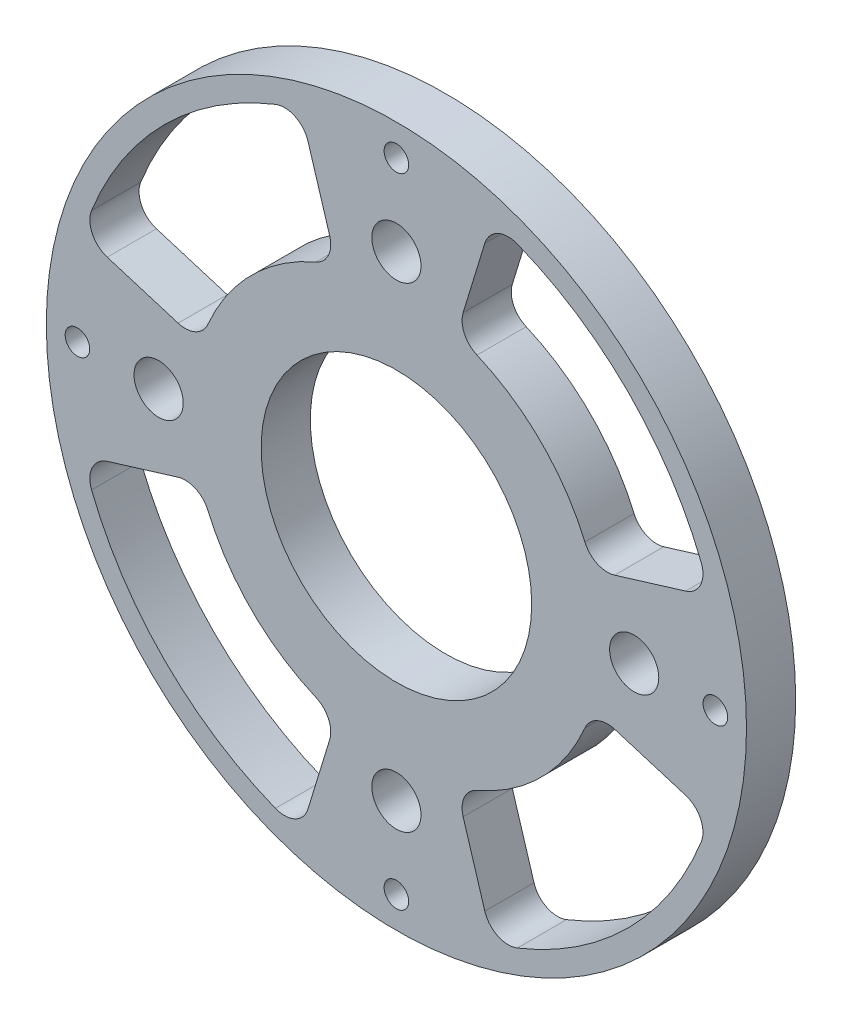
from build123d import *

# Parameters (mm, degrees)
SKETCH_2_R          = 43
SKETCH_2_R_2        = 16.5
EXTRUDE_1_DEPTH     = 6
SKETCH_3_R          = 3
SKETCH_3_R_2        = 1.5
CUT_EXTRUDE_1_DEPTH = 6
CUT_EXTRUDE_5_DEPTH = 6
FILLET_2_R          = 3
SKETCH_6_R          = 43
SKETCH_6_R_2        = 42.9
CUT_EXTRUDE_6_DEPTH = 6
CUT_EXTRUDE_START   = -6
SKETCH_7_R          = 42.9
SKETCH_7_R_2        = 42.7
CUT_EXTRUDE_7_DEPTH = 6


with BuildPart() as part:
    # 草图2 → 凸台-拉伸1 (new body)
    with BuildSketch(Plane.XY):
        Circle(SKETCH_2_R)
        Circle(SKETCH_2_R_2, mode=Mode.SUBTRACT)
    extrude(amount=-EXTRUDE_1_DEPTH)

    # 草图3 → 切除-拉伸1 (cut)
    with BuildSketch(Plane.XY):
        with Locations((0, 29)):
            Circle(SKETCH_3_R)
        with Locations((29, 0)):
            Circle(SKETCH_3_R)
        with Locations((0, -29)):
            Circle(SKETCH_3_R)
        with Locations((-29, 0)):
            Circle(SKETCH_3_R)
        with Locations((-38.9, 0)):
            Circle(SKETCH_3_R_2)
        with Locations((0, 38.9)):
            Circle(SKETCH_3_R_2)
        with Locations((38.9, 0)):
            Circle(SKETCH_3_R_2)
        with Locations((0, -38.9)):
            Circle(SKETCH_3_R_2)
    extrude(amount=-CUT_EXTRUDE_1_DEPTH, mode=Mode.SUBTRACT)

    # 草图4 → 切除-拉伸5 (cut)
    with BuildSketch(Plane.XY):
        with BuildLine():
            ThreePointArc((-23.907618899, 7.309292618), (-17.67766953, 17.67766953), (-7.309292618, 23.907618899))
            Line((-7.309292618, 23.907618899), (-11.694868189, 38.252190239))
            ThreePointArc((-11.694868189, 38.252190239), (-28.284271247, 28.284271247), (-38.252190239, 11.694868189))
            Line((-38.252190239, 11.694868189), (-23.907618899, 7.309292618))
        make_face()
        with BuildLine():
            Line((11.694868189, 38.252190239), (7.309292618, 23.907618899))
            ThreePointArc((7.309292618, 23.907618899), (17.67766953, 17.67766953), (23.907618899, 7.309292618))
            Line((23.907618899, 7.309292618), (38.252190239, 11.694868189))
            ThreePointArc((38.252190239, 11.694868189), (28.284271247, 28.284271247), (11.694868189, 38.252190239))
        make_face()
        with BuildLine():
            Line((38.252190239, -11.694868189), (23.907618899, -7.309292618))
            ThreePointArc((23.907618899, -7.309292618), (17.67766953, -17.67766953), (7.309292618, -23.907618899))
            Line((7.309292618, -23.907618899), (11.694868189, -38.252190239))
            ThreePointArc((11.694868189, -38.252190239), (28.284271247, -28.284271247), (38.252190239, -11.694868189))
        make_face()
        with BuildLine():
            ThreePointArc((-7.309292618, -23.907618899), (-17.67766953, -17.67766953), (-23.907618899, -7.309292618))
            Line((-23.907618899, -7.309292618), (-38.252190239, -11.694868189))
            ThreePointArc((-38.252190239, -11.694868189), (-28.284271247, -28.284271247), (-11.694868189, -38.252190239))
            Line((-11.694868189, -38.252190239), (-7.309292618, -23.907618899))
        make_face()
    extrude(amount=-CUT_EXTRUDE_5_DEPTH, mode=Mode.SUBTRACT)

    # 圆角2
    fillet_2_edges = [part.edges().sort_by_distance(p)[0] for p in [
        (-38.252190239, -11.694868189, -3),
        (-23.907618899, -7.309292618, -3),
        (-7.309292618, -23.907618899, -3),
        (-11.694868189, -38.252190239, -3),
        (11.694868189, -38.252190239, -3),
        (7.309292618, -23.907618899, -3),
        (23.907618899, -7.309292618, -3),
        (38.252190239, -11.694868189, -3),
        (38.252190239, 11.694868189, -3),
        (23.907618899, 7.309292618, -3),
        (7.309292618, 23.907618899, -3),
        (11.694868189, 38.252190239, -3),
        (-11.694868189, 38.252190239, -3),
        (-7.309292618, 23.907618899, -3),
        (-23.907618899, 7.309292618, -3),
        (-38.252190239, 11.694868189, -3),
    ]]
    fillet(fillet_2_edges, radius=FILLET_2_R)

    # 草图6 → 切除-拉伸6 (cut)
    with BuildSketch(Plane.XY):
        Circle(SKETCH_6_R)
        Circle(SKETCH_6_R_2, mode=Mode.SUBTRACT)
    extrude(amount=-CUT_EXTRUDE_6_DEPTH, mode=Mode.SUBTRACT)

    # 草图7 → 切除-拉伸7 (cut)
    with BuildSketch(Plane(origin=(0, 0, -6), x_dir=(-1, 0, 0), z_dir=(0, 0, -1)).offset(CUT_EXTRUDE_START)):
        Circle(SKETCH_7_R)
        Circle(SKETCH_7_R_2, mode=Mode.SUBTRACT)
    extrude(amount=CUT_EXTRUDE_7_DEPTH, mode=Mode.SUBTRACT)


solid = part.part
